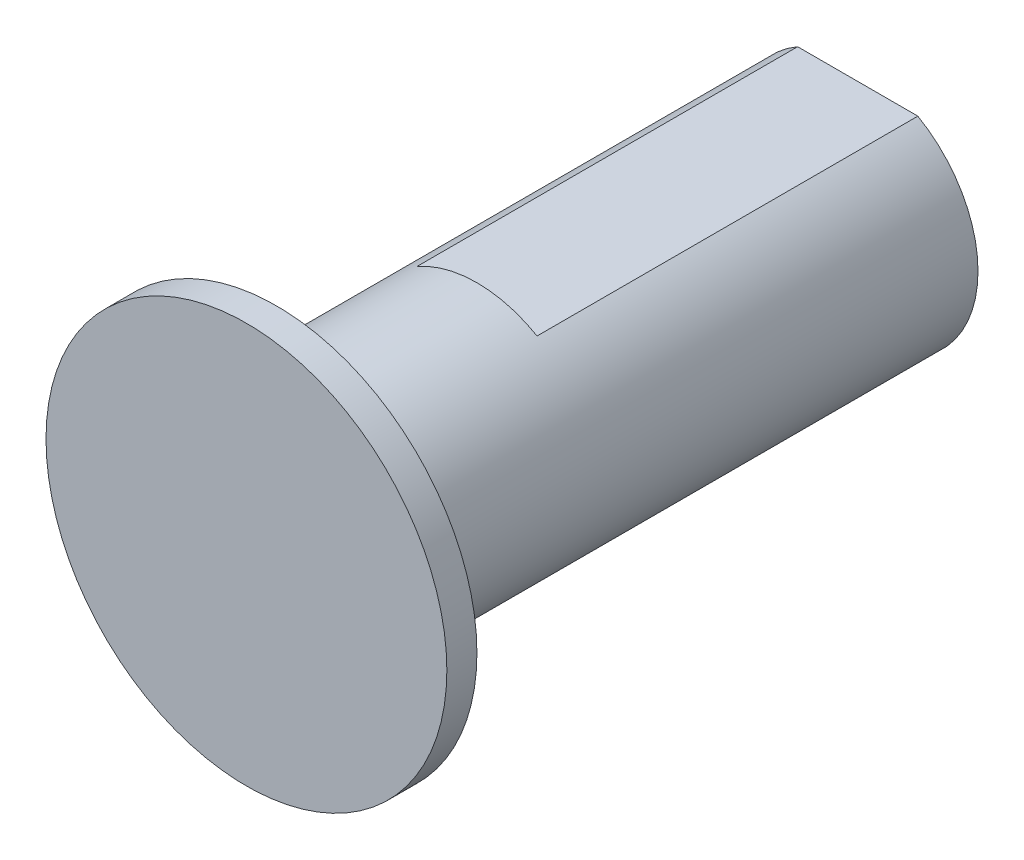
from build123d import *

# Parameters (mm, degrees)
SKETCH1_R           = 6
BOSS_EXTRUDE1_DEPTH = 29
CUT_EXTRUDE1_DEPTH  = 19
SKETCH3_R           = 10
BOSS_EXTRUDE2_DEPTH = 1.5


with BuildPart() as part:
    # Sketch1 → Boss-Extrude1 (new body)
    with BuildSketch(Plane.XY):
        with Locations(Location((0, 0, 0), (0, 0, 180))):
            Circle(SKETCH1_R)
    extrude(amount=BOSS_EXTRUDE1_DEPTH)

    # Sketch2 → Cut-Extrude1 (cut)
    with BuildSketch(Plane(origin=(0, 0, 0), x_dir=(-1, 0, 0), z_dir=(0, 0, -1))):
        Polygon((-41.730042052, 5.196152423), (-3, 5.196152423), (3, 5.196152423), (41.730042052, 5.196152423), (41.730042052, 82.656236526), (-41.730042052, 82.656236526), align=None)
    extrude(amount=-CUT_EXTRUDE1_DEPTH, mode=Mode.SUBTRACT)

    # Sketch3 → Boss-Extrude2 (add)
    with BuildSketch(Plane.XY.offset(29)):
        Circle(SKETCH3_R)
    extrude(amount=BOSS_EXTRUDE2_DEPTH)


solid = part.part
